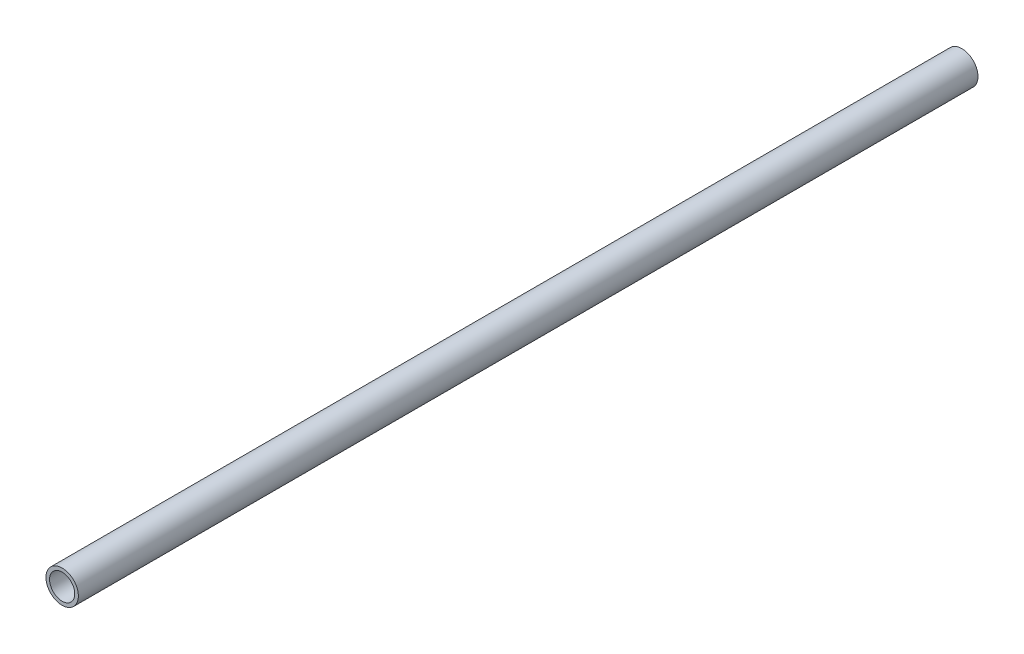
from build123d import *

# Parameters (mm, degrees)
SKETCH3_R           = 4.5
SKETCH3_R_2         = 3.5
BOSS_EXTRUDE1_DEPTH = 150
SKETCH4_R           = 4.5
CUT_EXTRUDE1_DEPTH  = 50


with BuildPart() as part:
    # Sketch3 → Boss-Extrude1 (new, symmetric)
    with BuildSketch(Plane.XY):
        Circle(SKETCH3_R)
        Circle(SKETCH3_R_2, mode=Mode.SUBTRACT)
    extrude(amount=BOSS_EXTRUDE1_DEPTH, both=True)

    # Sketch4 → Cut-Extrude1 (cut)
    with BuildSketch(Plane.XY.offset(150)):
        Circle(SKETCH4_R)
    extrude(amount=-CUT_EXTRUDE1_DEPTH, mode=Mode.SUBTRACT)


solid = part.part
